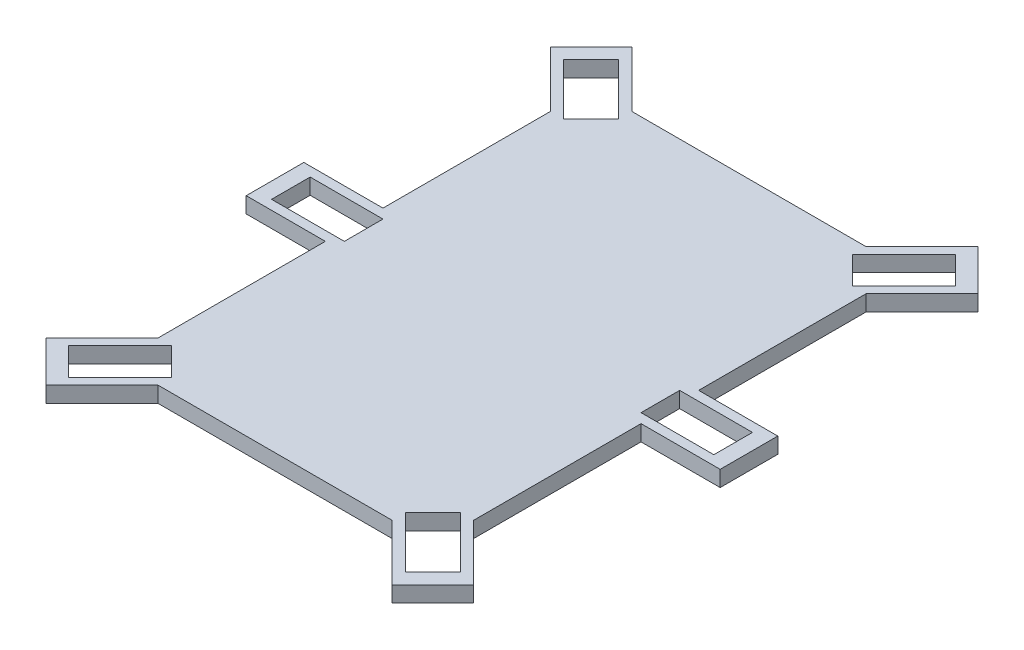
from build123d import *

# Parameters (mm, degrees)
SKETCH2_W           = 23
SKETCH2_H           = 12.2
BOSS_EXTRUDE1_DEPTH = 5


with BuildPart() as part:
    # Sketch2 → Boss-Extrude1 (new body)
    with BuildSketch(Plane(origin=(0, 0, 0), x_dir=(1, 0, 0), z_dir=(0, 1, 0))):
        Polygon((-154.967912227, 159.789086559), (-80.967912227, 159.789086559), (-63.290242697, 177.466756088), (-50.420899279, 164.597412671), (-68.098568809, 146.919743141), (-68.098568809, 94.019743141), (-43.098568809, 94.019743141), (-43.098568809, 75.819743141), (-68.098568809, 75.819743141), (-68.098568809, 22.919743141), (-50.420899279, 5.242073612), (-63.290242697, -7.627269806), (-80.967912227, 10.050399724), (-154.967912227, 10.050399724), (-172.645581756, -7.627269806), (-185.514925174, 5.242073612), (-167.837255644, 22.919743141), (-167.837255644, 75.819743141), (-192.837255644, 75.819743141), (-192.837255644, 94.019743141), (-167.837255644, 94.019743141), (-167.837255644, 146.919743141), (-185.514925174, 164.597412671), (-172.645581756, 177.466756088), align=None)
        Polygon((-171.231368194, 171.809901839), (-154.967912227, 155.546445872), (-163.678194925, 146.836163173), (-179.941650892, 163.099619141), align=None, mode=Mode.SUBTRACT)
        with Locations((-176.337255644, 84.919743141)):
            Rectangle(SKETCH2_W, SKETCH2_H, mode=Mode.SUBTRACT)
        Polygon((-80.967912227, 155.546445872), (-72.257629528, 146.836163173), (-55.994173561, 163.099619141), (-64.704456259, 171.809901839), align=None, mode=Mode.SUBTRACT)
        Polygon((-64.704456259, -1.970415557), (-80.967912227, 14.293040411), (-72.257629528, 23.003323109), (-55.994173561, 6.739867142), align=None, mode=Mode.SUBTRACT)
        Polygon((-154.967912227, 14.293040411), (-163.678194925, 23.003323109), (-179.941650892, 6.739867142), (-171.231368194, -1.970415557), align=None, mode=Mode.SUBTRACT)
        with Locations((-59.598568809, 84.919743141)):
            Rectangle(SKETCH2_W, SKETCH2_H, mode=Mode.SUBTRACT)
    extrude(amount=BOSS_EXTRUDE1_DEPTH)


solid = part.part
